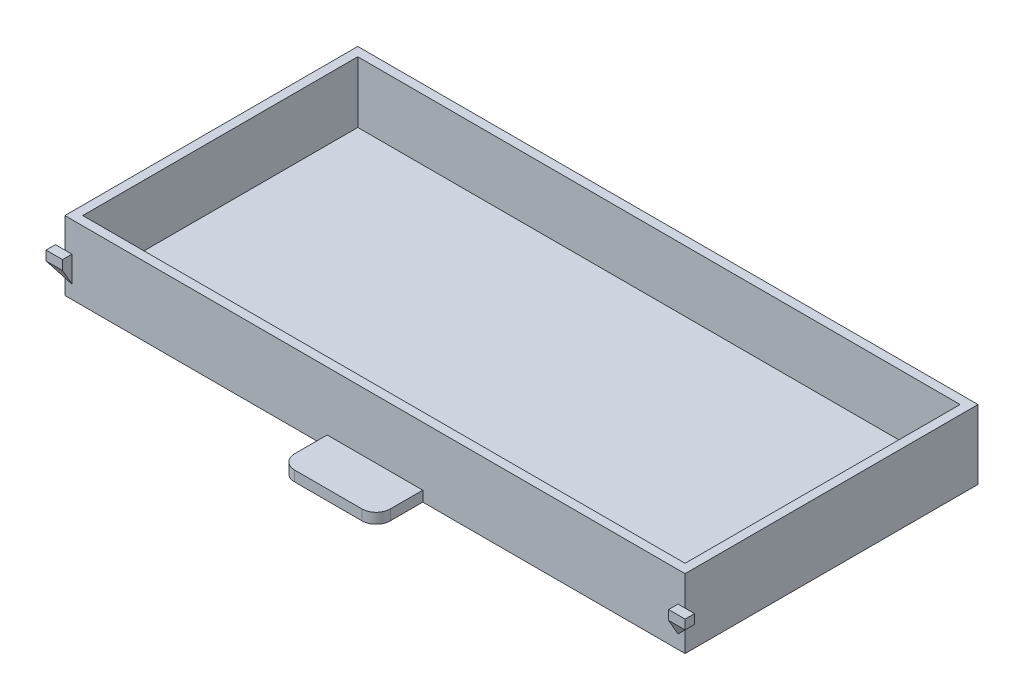
from build123d import *

# Parameters (mm, degrees)
SKETCH2_W           = 131.7
SKETCH2_H           = 62.2
BOSS_EXTRUDE1_DEPTH = 14.7
SKETCH3_W           = 127.9
SKETCH3_H           = 58.4
CUT_EXTRUDE1_DEPTH  = 13
SKETCH4_W           = 20.3
SKETCH4_H           = 9.9
BOSS_EXTRUDE2_DEPTH = 2.2
FILLET1_R           = 3
SKETCH5_W           = 1.5
SKETCH5_H           = 2
SKETCH5_W_2         = 2
BOSS_EXTRUDE3_DEPTH = 2
CUT_EXTRUDE2_DEPTH  = 200


with BuildPart() as part:
    # Sketch2 → Boss-Extrude1 (new body)
    with BuildSketch(Plane(origin=(0, 0, 0), x_dir=(1, 0, 0), z_dir=(0, 1, 0))):
        Rectangle(SKETCH2_W, SKETCH2_H)
    extrude(amount=BOSS_EXTRUDE1_DEPTH)

    # Sketch3 → Cut-Extrude1 (cut)
    with BuildSketch(Plane(origin=(0, 14.7, 0), x_dir=(1, 0, 0), z_dir=(0, 1, 0))):
        Rectangle(SKETCH3_W, SKETCH3_H)
    extrude(amount=-CUT_EXTRUDE1_DEPTH, mode=Mode.SUBTRACT)

    # Sketch4 → Boss-Extrude2 (add)
    with BuildSketch(Plane.XZ):
        with Locations((0, 36.05)):
            Rectangle(SKETCH4_W, SKETCH4_H)
    extrude(amount=-BOSS_EXTRUDE2_DEPTH)

    # Fillet1
    fillet1_edges = [part.edges().sort_by_distance(p)[0] for p in [
        (-10.15, 1.1, 41),
        (10.15, 1.1, 41),
    ]]
    fillet(fillet1_edges, radius=FILLET1_R)

    # Sketch5 → Boss-Extrude3 (add)
    with BuildSketch(Plane.XY.offset(31.1)):
        with Locations((-65.1, 7.35)):
            Rectangle(SKETCH5_W, SKETCH5_H)
        with Locations((-66.85, 7.35)):
            Rectangle(SKETCH5_W_2, SKETCH5_H)
        Polygon((-65.85, 4.35), (-65.85, 6.35), (-67.85, 6.35), align=None)
        Polygon((-64.35, 6.35), (-65.85, 6.35), (-65.85, 4.35), (-64.35, 2.85), align=None)
    boss_extrude3 = extrude(amount=BOSS_EXTRUDE3_DEPTH)

    # Mirror1: Boss-Extrude3 across plane
    add(boss_extrude3.mirror(Plane(origin=(0, 0, 0), x_dir=(0, 0, 1), z_dir=(1, 0, 0))))

    # Sketch6 → Cut-Extrude2 (cut, symmetric)
    with BuildSketch(Plane.ZY.offset(65.85)):
        Polygon((33.1, 6.35), (31.1, 2.85), (33.1, 2.85), align=None)
    extrude(amount=CUT_EXTRUDE2_DEPTH, both=True, mode=Mode.SUBTRACT)


solid = part.part
